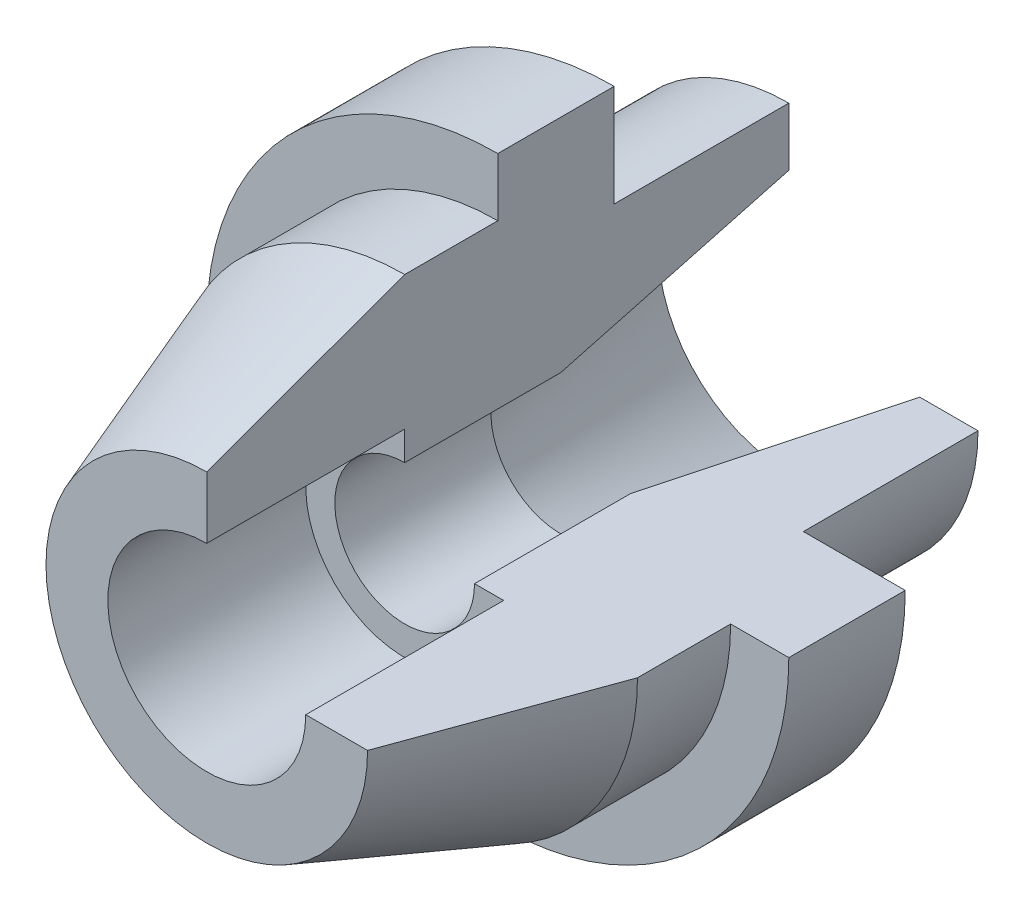
from build123d import *

# Parameters (mm, degrees)
REVOLVE1_ANGLE = 270


with BuildPart() as part:
    # Sketch1 → Revolve1 (revolve)
    with BuildSketch(Plane(origin=(0, 0, 0), x_dir=(0, 0, -1), z_dir=(1, 0, 0))):
        Polygon((0, 17), (0, 27.625012035), (34, 40), (50, 40), (50, 50), (70, 50), (70, 32.5), (100, 32.5), (100, 22.5), (60.813466521, 12), (34, 12), (34, 17), align=None)
    revolve(axis=Axis((0, 0, 0), (0, 0, 1)), revolution_arc=REVOLVE1_ANGLE)


solid = part.part
